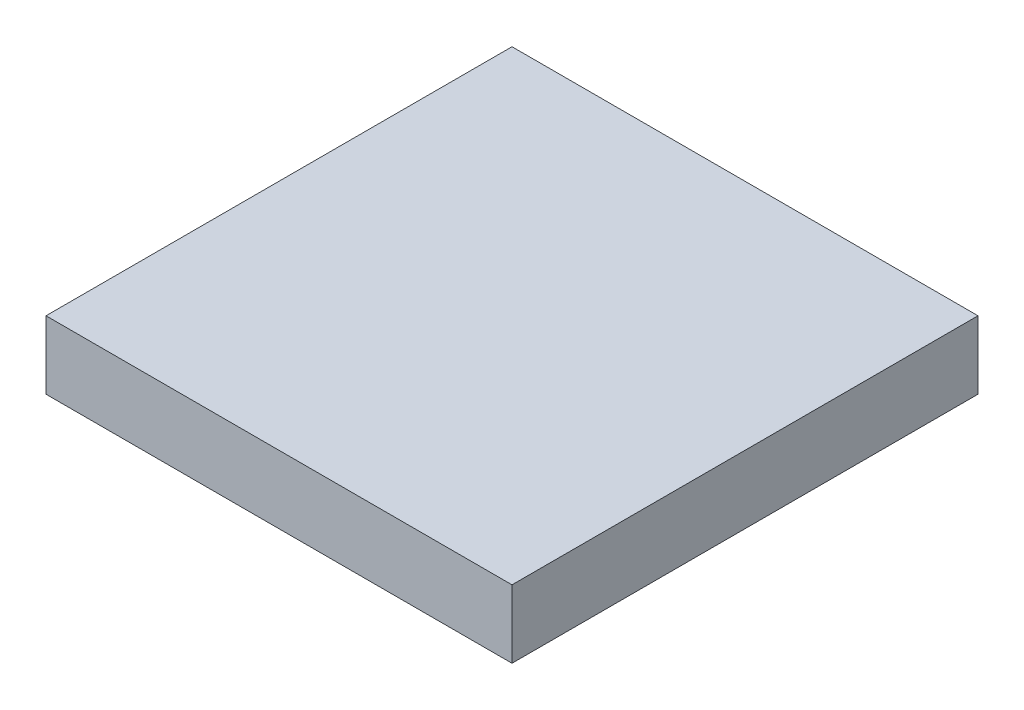
from build123d import *

# Parameters (mm, degrees)
SKETCH3_W           = 152.4
SKETCH3_H           = 22.225
BOSS_EXTRUDE1_DEPTH = 76.2


with BuildPart() as part:
    # Sketch3 → Boss-Extrude1 (new, symmetric)
    with BuildSketch(Plane.XY):
        Rectangle(SKETCH3_W, SKETCH3_H)
    extrude(amount=BOSS_EXTRUDE1_DEPTH, both=True)


solid = part.part
